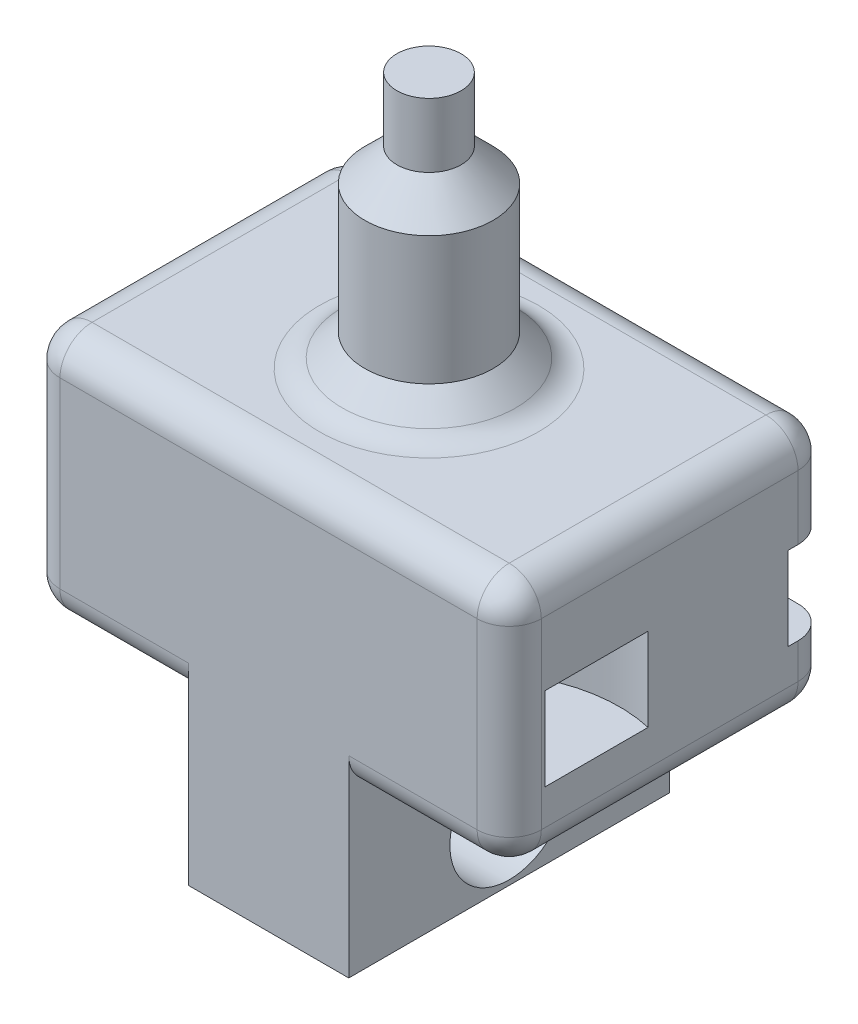
from build123d import *

# Parameters (mm, degrees)
ESBO_O2_W                     = 100
ESBO_O2_H                     = 60
RESSALTO_EXTRUS_O1_DEPTH      = 50
RESSALTO_EXTRUS_O2_DEPTH      = 50
RESSALTO_EXTRUS_O2_DEPTH_BACK = 100
ESBO_O3_W                     = 100
ESBO_O3_H                     = 76.966331483
ESBO_O4_R                     = 20
RESSALTO_EXTRUS_O3_DEPTH      = 60
FILETE1_R                     = 10
CHANFRO1_SIZE                 = 10
ESBO_O6_R                     = 18.5
CORTE_EXTRUS_O1_DEPTH         = 243.47832014
ESBO_O7_R                     = 14.082818634
ESBO_O7_R_2                   = 15.375713497
CORTE_EXTRUS_O2_DEPTH         = 27
ESBO_O8_R                     = 10
RESSALTO_EXTRUS_O4_DEPTH      = 20
FILETE2_R                     = 10
CHANFRO2_SIZE                 = 10
ESBO_O10_W                    = 27.587633248
ESBO_O10_H                    = 25.966331483
ESBO_O10_W_2                  = 29.412366752
CORTE_REVOLU_O1_ANGLE         = 325


with BuildPart() as part:
    # Esboço2 → Ressalto-extrusão1 (new body)
    with BuildSketch(Plane(origin=(0, 0, 0), x_dir=(0, 0, -1), z_dir=(1, 0, 0))):
        with Locations((50, 30)):
            Rectangle(ESBO_O2_W, ESBO_O2_H)
    extrude(amount=RESSALTO_EXTRUS_O1_DEPTH)

    # Esboço3 → Ressalto-extrusão2 (add, two sides: drawn at the far end of the back side and taken through both)
    with BuildSketch(Plane.ZY.offset(-RESSALTO_EXTRUS_O2_DEPTH_BACK)):
        with Locations((-50, 98.483165742)):
            Rectangle(ESBO_O3_W, ESBO_O3_H)
    extrude(amount=RESSALTO_EXTRUS_O2_DEPTH + RESSALTO_EXTRUS_O2_DEPTH_BACK)

    # Esboço4 → Ressalto-extrusão3 (add)
    with BuildSketch(Plane(origin=(0, 136.966331483, 0), x_dir=(1, 0, 0), z_dir=(0, 1, 0))):
        with Locations(Location((25, 50, 0), (0, 0, 90))):
            Circle(ESBO_O4_R)
    extrude(amount=RESSALTO_EXTRUS_O3_DEPTH)

    # Filete1
    filete1_edges = [part.edges().sort_by_distance(p)[0] for p in [
        (-25, 60, -100),
        (75, 60, -100),
        (100, 60, -50),
        (-25, 60, 0),
        (75, 60, 0),
        (100, 98.483165742, 0),
        (25, 136.966331483, 0),
        (100, 136.966331483, -50),
        (25, 136.966331483, -100),
        (100, 98.483165742, -100),
        (-50, 60, -50),
        (-50, 98.483165742, 0),
        (-50, 136.966331483, -50),
        (-50, 98.483165742, -100),
    ]]
    fillet(filete1_edges, radius=FILETE1_R)

    # Chanfro1
    chanfro1_edges = [part.edges().sort_by_distance(p)[0] for p in [
        (25, 136.966331483, -30),
        (25, 196.966331483, -30),
    ]]
    chamfer(chanfro1_edges, length=CHANFRO1_SIZE)

    # Esboço6 → Corte-extrusão1 (cut, through all)
    with BuildSketch(Plane(origin=(50, 0, 0), x_dir=(0, 0, -1), z_dir=(1, 0, 0))):
        with Locations((50, 30)):
            Circle(ESBO_O6_R)
    extrude(amount=-CORTE_EXTRUS_O1_DEPTH, mode=Mode.SUBTRACT)

    # Esboço7 → Corte-extrusão2 (cut)
    with BuildSketch(Plane(origin=(0, 0, -100), x_dir=(-1, 0, 0), z_dir=(0, 0, -1))):
        with Locations((-25, 35)):
            Circle(ESBO_O7_R)
        with Locations((15, 99.947585823)):
            Circle(ESBO_O7_R_2)
        with Locations((-65, 99.947585823)):
            Circle(ESBO_O7_R_2)
    extrude(amount=-CORTE_EXTRUS_O2_DEPTH, mode=Mode.SUBTRACT)

    # Esboço8 → Ressalto-extrusão4 (add)
    with BuildSketch(Plane(origin=(0, 196.966331483, 0), x_dir=(1, 0, 0), z_dir=(0, 1, 0))):
        with Locations(Location((25, 50, 0), (0, 0, 270))):
            Circle(ESBO_O8_R)
    extrude(amount=RESSALTO_EXTRUS_O4_DEPTH)

    # Filete2
    filete2_edges = [part.edges().sort_by_distance(p)[0] for p in [
        (25, 136.966331483, -20),
    ]]
    fillet(filete2_edges, radius=FILETE2_R)

    # Chanfro2
    chanfro2_edges = [part.edges().sort_by_distance(p)[0] for p in [
        (50, 0, -50),
        (0, 0, -50),
        (25, 0, -100),
        (25, 0, 0),
    ]]
    chamfer(chanfro2_edges, length=CHANFRO2_SIZE)

    # Esboço10 → Corte-Revolução1 (revolve, cut)
    with BuildSketch(Plane.XY):
        with Locations((-11.206183376, 93.983165742)):
            Rectangle(ESBO_O10_W, ESBO_O10_H)
        with Locations((60.293816624, 93.983165742)):
            Rectangle(ESBO_O10_W_2, ESBO_O10_H)
    revolve(axis=Axis((90, 136.966331483, 0), (0, 1, 0)), revolution_arc=CORTE_REVOLU_O1_ANGLE, mode=Mode.SUBTRACT)


solid = part.part
